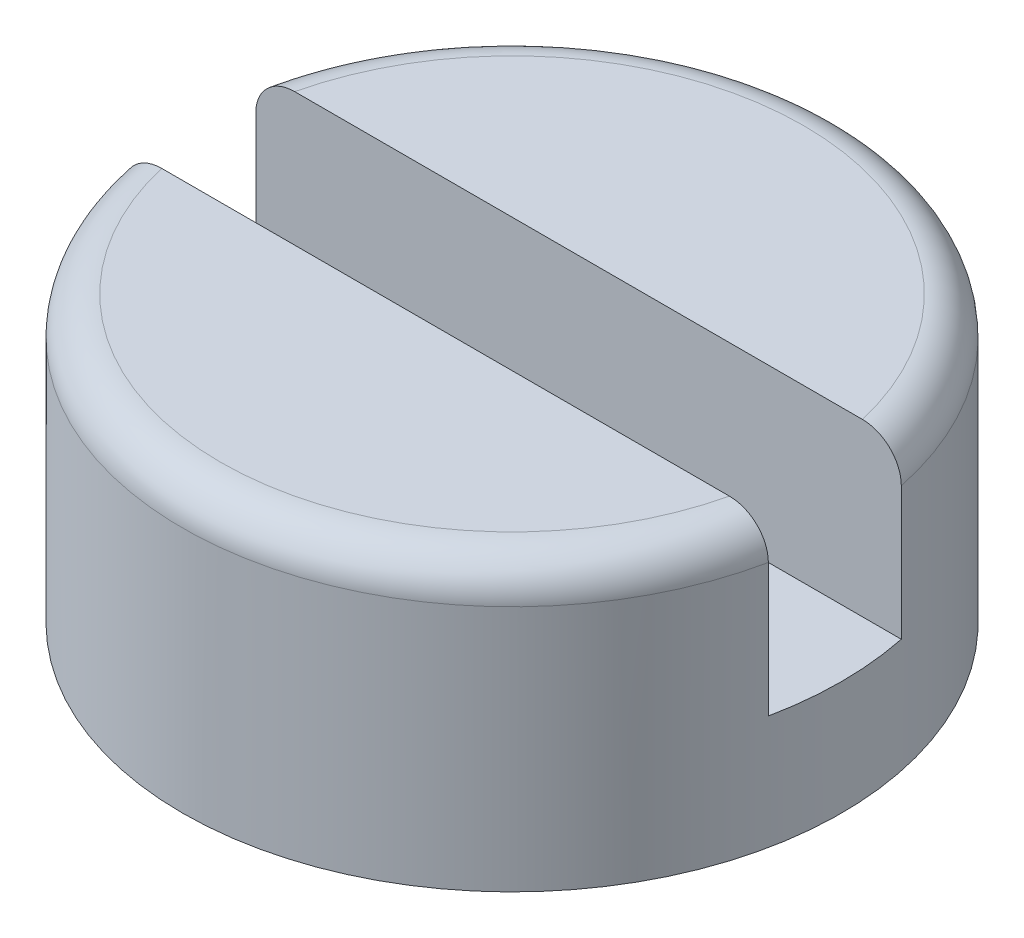
from build123d import *

# Parameters (mm, degrees)
SKETCH_1_R          = 1.735
EXTRUDE_1_DEPTH     = 1.5
SKETCH_2_W          = 3.5
SKETCH_2_H          = 0.7
CUT_EXTRUDE_1_DEPTH = 0.9
FILLET_2_R          = 0.2


with BuildPart() as part:
    # Эскиз1 → Бобышка-Вытянуть1 (new body)
    with BuildSketch(Plane(origin=(0, 0, 0), x_dir=(1, 0, 0), z_dir=(0, 1, 0))):
        with Locations(Location((0, 0, 0), (0, 0, 270))):
            Circle(SKETCH_1_R)
    extrude(amount=EXTRUDE_1_DEPTH)

    # Эскиз2 → Вырез-Вытянуть1 (cut)
    with BuildSketch(Plane(origin=(0, 1.5, 0), x_dir=(1, 0, 0), z_dir=(0, 1, 0))):
        Rectangle(SKETCH_2_W, SKETCH_2_H)
    extrude(amount=-CUT_EXTRUDE_1_DEPTH, mode=Mode.SUBTRACT)

    # Скругление2
    fillet_2_edges = [part.edges().sort_by_distance(p)[0] for p in [
        (0, 1.5, -1.735),
        (-1.096123852, 1.5, 1.344893118),
    ]]
    fillet(fillet_2_edges, radius=FILLET_2_R)


solid = part.part
